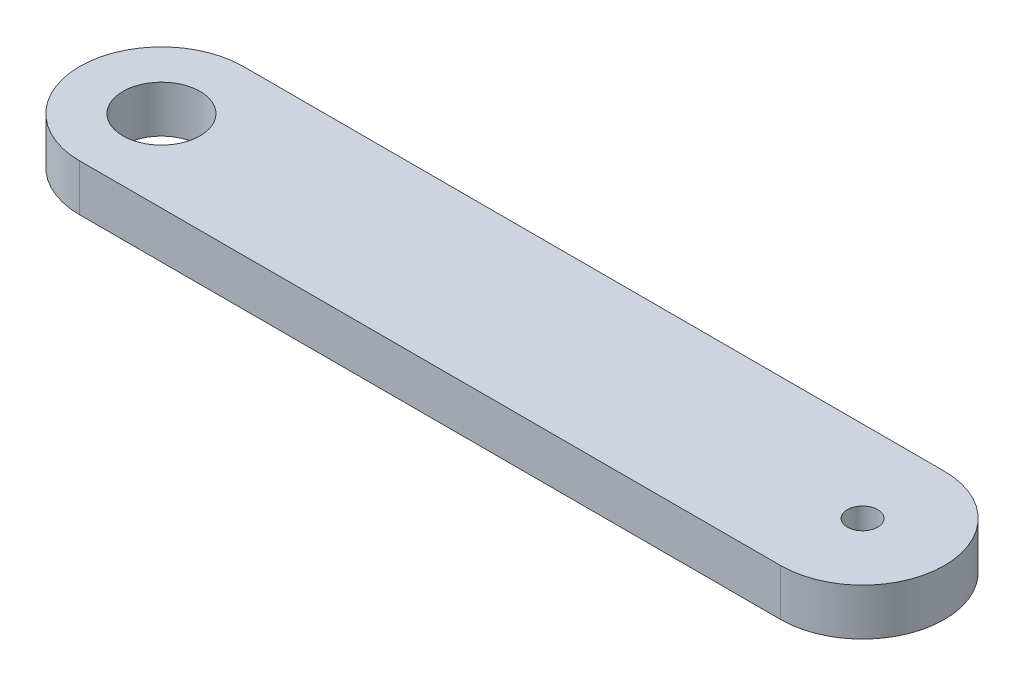
from build123d import *

# Parameters (mm, degrees)
SKETCH1_R           = 8.25
SKETCH1_R_2         = 3.25
BOSS_EXTRUDE1_DEPTH = 10


with BuildPart() as part:
    # Sketch1 → Boss-Extrude1 (new body)
    with BuildSketch(Plane(origin=(0, 0, 0), x_dir=(1, 0, 0), z_dir=(0, 1, 0))):
        with BuildLine():
            Line((0, 17.5), (150, 17.5))
            ThreePointArc((150, 17.5), (167.5, 0), (150, -17.5))
            Line((150, -17.5), (0, -17.5))
            ThreePointArc((0, -17.5), (-17.5, 0), (0, 17.5))
        make_face()
        with Locations(Location((0, 0, 0), (0, 0, 270))):
            Circle(SKETCH1_R, mode=Mode.SUBTRACT)
        with Locations(Location((150, 0, 0), (0, 0, 270))):
            Circle(SKETCH1_R_2, mode=Mode.SUBTRACT)
    extrude(amount=BOSS_EXTRUDE1_DEPTH)


solid = part.part
